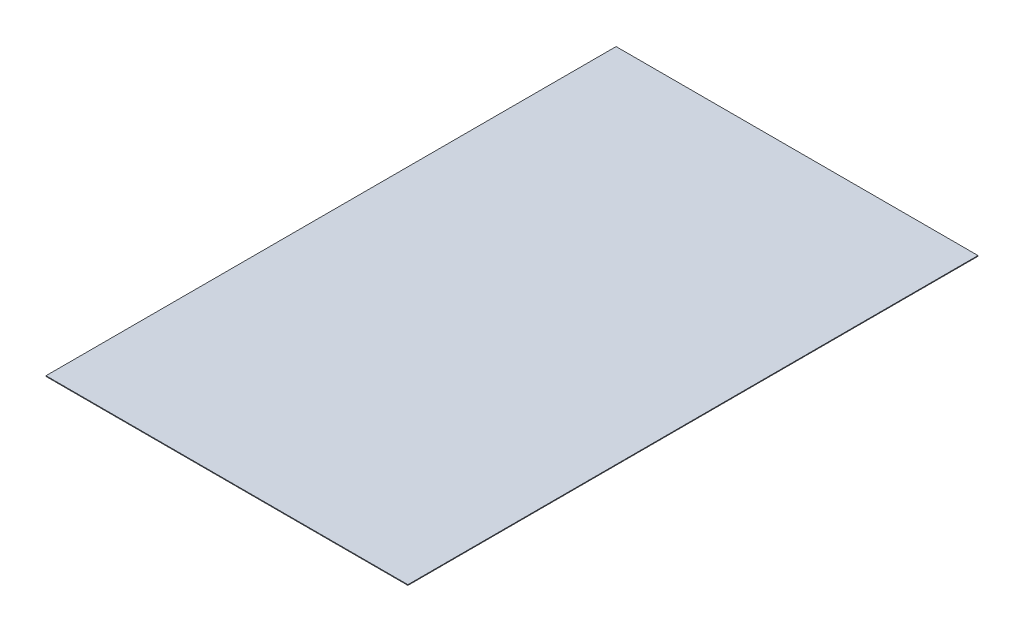
from build123d import *

# Parameters (mm, degrees)
SKETCH1_W           = 5320
SKETCH1_H           = 8380
BOSS_EXTRUDE1_DEPTH = 10


with BuildPart() as part:
    # Sketch1 → Boss-Extrude1 (new body)
    with BuildSketch(Plane(origin=(0, 0, 0), x_dir=(1, 0, 0), z_dir=(0, 1, 0))):
        with Locations((2660, -4190)):
            Rectangle(SKETCH1_W, SKETCH1_H)
    extrude(amount=BOSS_EXTRUDE1_DEPTH)


solid = part.part
